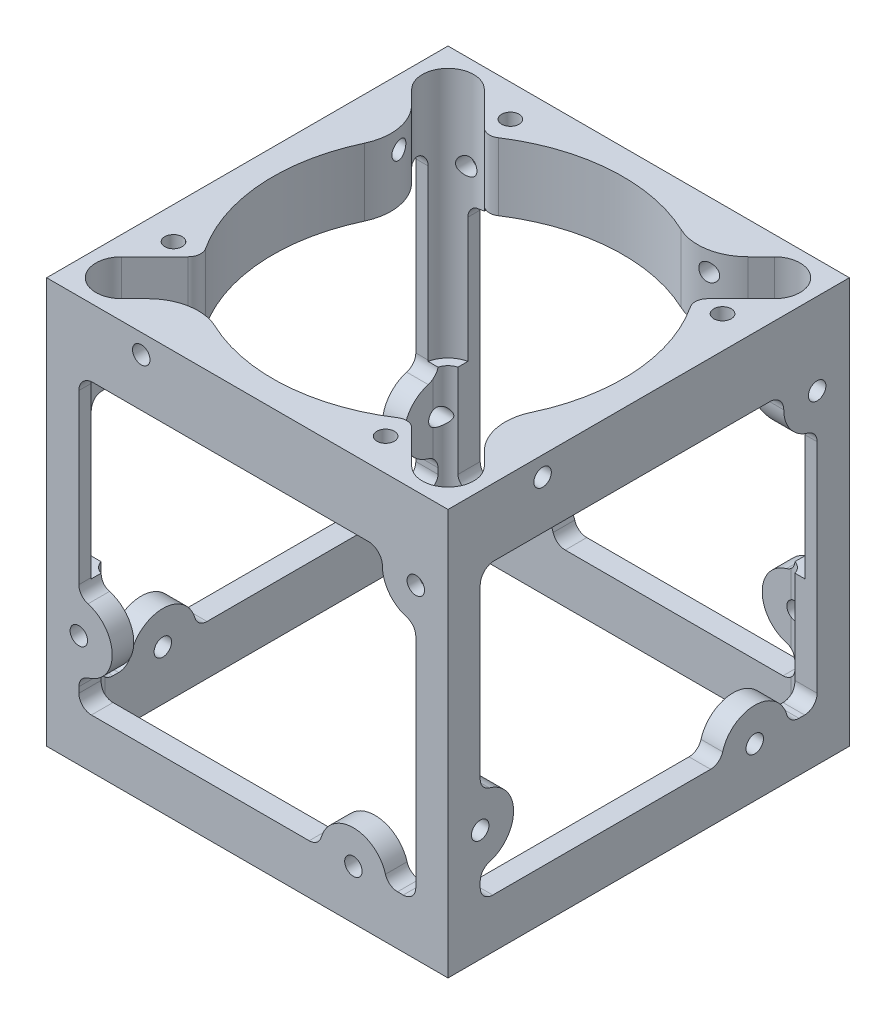
from build123d import *

# Parameters (mm, degrees)
SKETCH1_W           = 50.8
SKETCH1_H           = 50.8
BOSS_EXTRUDE1_DEPTH = 47.5488
CUT_EXTRUDE1_DEPTH  = 33.02
SKETCH4_R           = 1.1049
CUT_EXTRUDE3_DEPTH  = 6.985
SKETCH5_R           = 0.5
SKETCH5_R_2         = 1.1049
CUT_EXTRUDE5_DEPTH  = 6.985
SKETCH6_R           = 0.5
SKETCH6_R_2         = 1.1049
CUT_EXTRUDE6_DEPTH  = 6.985
SKETCH7_R           = 0.5
SKETCH7_R_2         = 1.1049
CUT_EXTRUDE7_DEPTH  = 6.985
CUT_EXTRUDE8_START  = -6.985
SKETCH8_R           = 0.5
SKETCH8_R_2         = 1.1049
CUT_EXTRUDE8_DEPTH  = 6.985
CUT_EXTRUDE9_START  = -6.985
SKETCH9_R           = 0.5
SKETCH9_R_2         = 1.1049
CUT_EXTRUDE9_DEPTH  = 6.985
CUT_EXTRUDE10_DEPTH = 10
CUT_EXTRUDE11_DEPTH = 8.89
CUT_EXTRUDE13_START = -9.99998
CUT_EXTRUDE13_DEPTH = 9.99998
CUT_EXTRUDE14_START = -9.99998
CUT_EXTRUDE14_DEPTH = 9.99998
CUT_EXTRUDE15_DEPTH = 31.75
BOSS_EXTRUDE2_START = 3.81
SKETCH16_W          = 50.8
SKETCH16_H          = 50.8
SKETCH16_R          = 1.1049
BOSS_EXTRUDE2_DEPTH = 3.81


with BuildPart() as part:
    # Sketch1 → Boss-Extrude1 (new body)
    with BuildSketch(Plane(origin=(0, 0, 0), x_dir=(1, 0, 0), z_dir=(0, 1, 0))):
        Rectangle(SKETCH1_W, SKETCH1_H)
    extrude(amount=BOSS_EXTRUDE1_DEPTH)

    # Sketch2 → Cut-Extrude1 (cut)
    with BuildSketch(Plane(origin=(0, 0, 0), x_dir=(-1, 0, 0), z_dir=(0, -1, 0))):
        with BuildLine():
            Line((20.7645, -22.6695), (-20.7645, -22.6695))
            ThreePointArc((-20.7645, -22.6695), (-22.111538418, -22.111538418), (-22.6695, -20.7645))
            Line((-22.6695, -20.7645), (-22.6695, 20.7645))
            ThreePointArc((-22.6695, 20.7645), (-22.111538418, 22.111538418), (-20.7645, 22.6695))
            Line((-20.7645, 22.6695), (20.7645, 22.6695))
            ThreePointArc((20.7645, 22.6695), (22.111538418, 22.111538418), (22.6695, 20.7645))
            Line((22.6695, 20.7645), (22.6695, -20.7645))
            ThreePointArc((22.6695, -20.7645), (22.111538418, -22.111538418), (20.7645, -22.6695))
        make_face()
    extrude(amount=-CUT_EXTRUDE1_DEPTH, mode=Mode.SUBTRACT)

    # Sketch4 → Cut-Extrude3 (cut)
    with BuildSketch(Plane(origin=(0, 0, 0), x_dir=(-1, 0, 0), z_dir=(0, -1, 0))):
        with Locations(Location((-23.495, -23.495, 0), (0, 0, 90))):
            Circle(SKETCH4_R)
        with Locations(Location((23.495, -23.495, 0), (0, 0, 270))):
            Circle(SKETCH4_R)
        with Locations(Location((-23.495, 23.495, 0), (0, 0, 270))):
            Circle(SKETCH4_R)
        with Locations(Location((23.495, 23.495, 0), (0, 0, 90))):
            Circle(SKETCH4_R)
    extrude(amount=-CUT_EXTRUDE3_DEPTH, mode=Mode.SUBTRACT)

    # Sketch5 → Cut-Extrude5 (cut)
    with BuildSketch(Plane(origin=(0, 0, -25.4), x_dir=(-1, 0, 0), z_dir=(0, 0, -1))):
        with Locations((-20.574, 23.7744)):
            Circle(SKETCH5_R)
        with Locations((20.574, 23.7744)):
            Circle(SKETCH5_R)
        with Locations((-21.3233, 10.3505)):
            Circle(SKETCH5_R_2)
        with Locations((-13.4239, 45.0977)):
            Circle(SKETCH5_R_2)
        with Locations((13.4239, 2.4511)):
            Circle(SKETCH5_R_2)
        with Locations(Location((21.3233, 37.1983, 0), (0, 0, 180))):
            Circle(SKETCH5_R_2)
    extrude(amount=-CUT_EXTRUDE5_DEPTH, mode=Mode.SUBTRACT)

    # Sketch6 → Cut-Extrude6 (cut)
    with BuildSketch(Plane.ZY.offset(25.4)):
        with Locations((20.574, 23.7744)):
            Circle(SKETCH6_R)
        with Locations((-20.574, 23.7744)):
            Circle(SKETCH6_R)
        with Locations((-21.3233, 10.3505)):
            Circle(SKETCH6_R_2)
        with Locations((-13.4239, 45.0977)):
            Circle(SKETCH6_R_2)
        with Locations((13.4239, 2.4511)):
            Circle(SKETCH6_R_2)
        with Locations((21.3233, 37.1983)):
            Circle(SKETCH6_R_2)
    extrude(amount=-CUT_EXTRUDE6_DEPTH, mode=Mode.SUBTRACT)

    # Sketch7 → Cut-Extrude7 (cut)
    with BuildSketch(Plane(origin=(0, 47.5488, 0), x_dir=(1, 0, 0), z_dir=(0, 1, 0))):
        with Locations(Location((20.574, 0, 0), (0, 0, 270))):
            Circle(SKETCH7_R)
        with Locations(Location((-20.574, 0, 0), (0, 0, 270))):
            Circle(SKETCH7_R)
        with Locations(Location((-21.3233, -13.4239, 0), (0, 0, 270))):
            Circle(SKETCH7_R_2)
        with Locations(Location((-13.4239, 21.3233, 0), (0, 0, 270))):
            Circle(SKETCH7_R_2)
        with Locations(Location((13.4239, -21.3233, 0), (0, 0, 270))):
            Circle(SKETCH7_R_2)
        with Locations(Location((21.3233, 13.4239, 0), (0, 0, 270))):
            Circle(SKETCH7_R_2)
    extrude(amount=-CUT_EXTRUDE7_DEPTH, mode=Mode.SUBTRACT)

    # Sketch8 → Cut-Extrude8 (cut)
    with BuildSketch(Plane.XY.offset(25.4).offset(CUT_EXTRUDE8_START)):
        with Locations(Location((-20.574, 23.7744, 0), (0, 0, 180))):
            Circle(SKETCH8_R)
        with Locations(Location((20.574, 23.7744, 0), (0, 0, 180))):
            Circle(SKETCH8_R)
        with Locations(Location((-21.3233, 10.3505, 0), (0, 0, 300.380960859))):
            Circle(SKETCH8_R_2)
        with Locations(Location((-13.4239, 45.0977, 0), (0, 0, 180))):
            Circle(SKETCH8_R_2)
        with Locations((13.4239, 2.4511)):
            Circle(SKETCH8_R_2)
        with Locations(Location((21.3233, 37.1983, 0), (0, 0, 180))):
            Circle(SKETCH8_R_2)
    extrude(amount=CUT_EXTRUDE8_DEPTH, mode=Mode.SUBTRACT)

    # Sketch9 → Cut-Extrude9 (cut)
    with BuildSketch(Plane(origin=(25.4, 0, 0), x_dir=(0, 0, -1), z_dir=(1, 0, 0)).offset(CUT_EXTRUDE9_START)):
        with Locations(Location((20.574, 23.7744, 0), (0, 0, 180))):
            Circle(SKETCH9_R)
        with Locations(Location((-20.574, 23.7744, 0), (0, 0, 180))):
            Circle(SKETCH9_R)
        with Locations((-21.3233, 10.3505)):
            Circle(SKETCH9_R_2)
        with Locations((-13.4239, 45.0977)):
            Circle(SKETCH9_R_2)
        with Locations((13.4239, 2.4511)):
            Circle(SKETCH9_R_2)
        with Locations((21.3233, 37.1983)):
            Circle(SKETCH9_R_2)
    extrude(amount=CUT_EXTRUDE9_DEPTH, mode=Mode.SUBTRACT)

    # Sketch10 → Cut-Extrude10 (cut)
    with BuildSketch(Plane.ZY.offset(25.4)):
        with BuildLine():
            Line((15.320052684, 38.998938084), (-19.5453, 38.998938084))
            ThreePointArc((-19.5453, 38.998938084), (-20.802535857, 38.478173941), (-21.3233, 37.220938084))
            Line((-21.3233, 37.220938084), (-21.3233, 15.942312884))
            ThreePointArc((-21.3233, 15.942312884), (-21.002374642, 14.985262768), (-20.169353638, 14.415162763))
            ThreePointArc((-20.169353638, 14.415162763), (-17.09801, 10.3505), (-20.169353638, 6.285837237))
            ThreePointArc((-20.169353638, 6.285837237), (-21.002374642, 5.715737232), (-21.3233, 4.758687116))
            Line((-21.3233, 4.758687116), (-21.3233, 4.0386))
            ThreePointArc((-21.3233, 4.0386), (-20.858332015, 2.916067985), (-19.7358, 2.4511))
            Line((-19.7358, 2.4511), (7.832087116, 2.4511))
            ThreePointArc((7.832087116, 2.4511), (8.789137232, 2.772025358), (9.359237237, 3.605046362))
            ThreePointArc((9.359237237, 3.605046362), (13.4239, 6.67639), (17.488562763, 3.605046362))
            ThreePointArc((17.488562763, 3.605046362), (18.058662768, 2.772025358), (19.015712884, 2.4511))
            Line((19.015712884, 2.4511), (19.7358, 2.4511))
            ThreePointArc((19.7358, 2.4511), (20.858332015, 2.916067985), (21.3233, 4.0386))
            Line((21.3233, 4.0386), (21.3233, 31.606487116))
            ThreePointArc((21.3233, 31.606487116), (21.002374642, 32.563537232), (20.169353638, 33.133637237))
            ThreePointArc((20.169353638, 33.133637237), (17.947388078, 34.657376097), (17.098040042, 37.214233342))
            ThreePointArc((17.098040042, 37.214233342), (16.579656795, 38.475801218), (15.320052684, 38.998938084))
        make_face()
    extrude(amount=-CUT_EXTRUDE10_DEPTH, mode=Mode.SUBTRACT)

    # Sketch11 → Cut-Extrude11 (cut)
    with BuildSketch(Plane.XY.offset(25.4)):
        with BuildLine():
            Line((15.320052684, 38.998938084), (-19.5453, 38.998938084))
            ThreePointArc((-19.5453, 38.998938084), (-20.802535857, 38.478173941), (-21.3233, 37.220938084))
            Line((-21.3233, 37.220938084), (-21.3233, 15.942312884))
            ThreePointArc((-21.3233, 15.942312884), (-21.002374642, 14.985262768), (-20.169353638, 14.415162763))
            ThreePointArc((-20.169353638, 14.415162763), (-17.09801, 10.3505), (-20.169353638, 6.285837237))
            ThreePointArc((-20.169353638, 6.285837237), (-21.002374642, 5.715737232), (-21.3233, 4.758687116))
            Line((-21.3233, 4.758687116), (-21.3233, 4.0386))
            ThreePointArc((-21.3233, 4.0386), (-20.858332015, 2.916067985), (-19.7358, 2.4511))
            Line((-19.7358, 2.4511), (7.832087116, 2.4511))
            ThreePointArc((7.832087116, 2.4511), (8.789137232, 2.772025358), (9.359237237, 3.605046362))
            ThreePointArc((9.359237237, 3.605046362), (13.4239, 6.67639), (17.488562763, 3.605046362))
            ThreePointArc((17.488562763, 3.605046362), (18.058662768, 2.772025358), (19.015712884, 2.4511))
            Line((19.015712884, 2.4511), (19.7358, 2.4511))
            ThreePointArc((19.7358, 2.4511), (20.858332015, 2.916067985), (21.3233, 4.0386))
            Line((21.3233, 4.0386), (21.3233, 31.606487116))
            ThreePointArc((21.3233, 31.606487116), (21.002374642, 32.563537232), (20.169353638, 33.133637237))
            ThreePointArc((20.169353638, 33.133637237), (17.947388078, 34.657376097), (17.098040042, 37.214233342))
            ThreePointArc((17.098040042, 37.214233342), (16.579656795, 38.475801218), (15.320052684, 38.998938084))
        make_face()
    extrude(amount=-CUT_EXTRUDE11_DEPTH, mode=Mode.SUBTRACT)

    # Sketch13 → Cut-Extrude13 (cut)
    with BuildSketch(Plane(origin=(0, 0, -25.4), x_dir=(-1, 0, 0), z_dir=(0, 0, -1)).offset(CUT_EXTRUDE13_START)):
        with BuildLine():
            Line((15.320052684, 38.998938084), (-19.5453, 38.998938084))
            ThreePointArc((-19.5453, 38.998938084), (-20.802535857, 38.478173941), (-21.3233, 37.220938084))
            Line((-21.3233, 37.220938084), (-21.3233, 15.942312884))
            ThreePointArc((-21.3233, 15.942312884), (-21.002374642, 14.985262768), (-20.169353638, 14.415162763))
            ThreePointArc((-20.169353638, 14.415162763), (-17.09801, 10.3505), (-20.169353638, 6.285837237))
            ThreePointArc((-20.169353638, 6.285837237), (-21.002374642, 5.715737232), (-21.3233, 4.758687116))
            Line((-21.3233, 4.758687116), (-21.3233, 4.0386))
            ThreePointArc((-21.3233, 4.0386), (-20.858332015, 2.916067985), (-19.7358, 2.4511))
            Line((-19.7358, 2.4511), (7.832087116, 2.4511))
            ThreePointArc((7.832087116, 2.4511), (8.789137232, 2.772025358), (9.359237237, 3.605046362))
            ThreePointArc((9.359237237, 3.605046362), (13.4239, 6.67639), (17.488562763, 3.605046362))
            ThreePointArc((17.488562763, 3.605046362), (18.058662768, 2.772025358), (19.015712884, 2.4511))
            Line((19.015712884, 2.4511), (19.7358, 2.4511))
            ThreePointArc((19.7358, 2.4511), (20.858332015, 2.916067985), (21.3233, 4.0386))
            Line((21.3233, 4.0386), (21.3233, 31.606487116))
            ThreePointArc((21.3233, 31.606487116), (21.002374642, 32.563537232), (20.169353638, 33.133637237))
            ThreePointArc((20.169353638, 33.133637237), (17.947388078, 34.657376097), (17.098040042, 37.214233342))
            ThreePointArc((17.098040042, 37.214233342), (16.579656795, 38.475801218), (15.320052684, 38.998938084))
        make_face()
    extrude(amount=CUT_EXTRUDE13_DEPTH, mode=Mode.SUBTRACT)

    # Sketch14 → Cut-Extrude14 (cut)
    with BuildSketch(Plane(origin=(25.4, 0, 0), x_dir=(0, 0, -1), z_dir=(1, 0, 0)).offset(CUT_EXTRUDE14_START)):
        with BuildLine():
            Line((15.320052684, 38.998938084), (-19.5453, 38.998938084))
            ThreePointArc((-19.5453, 38.998938084), (-20.802535857, 38.478173941), (-21.3233, 37.220938084))
            Line((-21.3233, 37.220938084), (-21.3233, 15.942312884))
            ThreePointArc((-21.3233, 15.942312884), (-21.002374642, 14.985262768), (-20.169353638, 14.415162763))
            ThreePointArc((-20.169353638, 14.415162763), (-17.09801, 10.3505), (-20.169353638, 6.285837237))
            ThreePointArc((-20.169353638, 6.285837237), (-21.002374642, 5.715737232), (-21.3233, 4.758687116))
            Line((-21.3233, 4.758687116), (-21.3233, 4.0386))
            ThreePointArc((-21.3233, 4.0386), (-20.858332015, 2.916067985), (-19.7358, 2.4511))
            Line((-19.7358, 2.4511), (7.832087116, 2.4511))
            ThreePointArc((7.832087116, 2.4511), (8.789137232, 2.772025358), (9.359237237, 3.605046362))
            ThreePointArc((9.359237237, 3.605046362), (13.4239, 6.67639), (17.488562763, 3.605046362))
            ThreePointArc((17.488562763, 3.605046362), (18.058662768, 2.772025358), (19.015712884, 2.4511))
            Line((19.015712884, 2.4511), (19.7358, 2.4511))
            ThreePointArc((19.7358, 2.4511), (20.858332015, 2.916067985), (21.3233, 4.0386))
            Line((21.3233, 4.0386), (21.3233, 31.606487116))
            ThreePointArc((21.3233, 31.606487116), (21.002374642, 32.563537232), (20.169353638, 33.133637237))
            ThreePointArc((20.169353638, 33.133637237), (17.947388078, 34.657376097), (17.098040042, 37.214233342))
            ThreePointArc((17.098040042, 37.214233342), (16.579656795, 38.475801218), (15.320052684, 38.998938084))
        make_face()
    extrude(amount=CUT_EXTRUDE14_DEPTH, mode=Mode.SUBTRACT)

    # Sketch15 → Cut-Extrude15 (cut)
    with BuildSketch(Plane(origin=(0, 47.5488, 0), x_dir=(1, 0, 0), z_dir=(0, 1, 0))):
        with BuildLine():
            Line((-18.355643511, 22.953534645), (-14.141887491, 18.739778625))
            ThreePointArc((-14.141887491, 18.739778625), (-13.181931515, 18.283157297), (-12.149077704, 18.534616079))
            ThreePointArc((-12.149077704, 18.534616079), (-1.531041807, 22.108550229), (9.478273295, 20.032334302))
            ThreePointArc((9.478273295, 20.032334302), (13.27924871, 19.515663572), (16.684238976, 21.28213011))
            Line((16.684238976, 21.28213011), (18.355643511, 22.953534645))
            ThreePointArc((18.355643511, 22.953534645), (22.953534645, 22.953534645), (22.953534645, 18.355643511))
            Line((22.953534645, 18.355643511), (18.739778625, 14.141887491))
            ThreePointArc((18.739778625, 14.141887491), (18.283157297, 13.181931515), (18.534616079, 12.149077704))
            ThreePointArc((18.534616079, 12.149077704), (22.108550229, 1.531041807), (20.032334302, -9.478273295))
            ThreePointArc((20.032334302, -9.478273295), (19.515663572, -13.27924871), (21.28213011, -16.684238976))
            Line((21.28213011, -16.684238976), (22.953534645, -18.355643511))
            ThreePointArc((22.953534645, -18.355643511), (22.953534645, -22.953534645), (18.355643511, -22.953534645))
            Line((18.355643511, -22.953534645), (14.141887491, -18.739778625))
            ThreePointArc((14.141887491, -18.739778625), (13.181931515, -18.283157297), (12.149077704, -18.534616079))
            ThreePointArc((12.149077704, -18.534616079), (1.531041807, -22.108550229), (-9.478273295, -20.032334302))
            ThreePointArc((-9.478273295, -20.032334302), (-13.27924871, -19.515663572), (-16.684238976, -21.28213011))
            Line((-16.684238976, -21.28213011), (-18.355643511, -22.953534645))
            ThreePointArc((-18.355643511, -22.953534645), (-22.953534645, -22.953534645), (-22.953534645, -18.355643511))
            Line((-22.953534645, -18.355643511), (-18.739778625, -14.141887491))
            ThreePointArc((-18.739778625, -14.141887491), (-18.283157297, -13.181931515), (-18.534616079, -12.149077704))
            ThreePointArc((-18.534616079, -12.149077704), (-22.108550229, -1.531041807), (-20.032334302, 9.478273295))
            ThreePointArc((-20.032334302, 9.478273295), (-19.515663572, 13.27924871), (-21.28213011, 16.684238976))
            Line((-21.28213011, 16.684238976), (-22.953534645, 18.355643511))
            ThreePointArc((-22.953534645, 18.355643511), (-22.953534645, 22.953534645), (-18.355643511, 22.953534645))
        make_face()
    extrude(amount=-CUT_EXTRUDE15_DEPTH, mode=Mode.SUBTRACT)

    # Sketch16 → Boss-Extrude2 (add)
    with BuildSketch(Plane(origin=(0, 0, 0), x_dir=(-1, 0, 0), z_dir=(0, -1, 0)).offset(BOSS_EXTRUDE2_START)):
        Rectangle(SKETCH16_W, SKETCH16_H)
        with Locations(Location((-23.495, 23.495, 0), (0, 0, 90))):
            Circle(SKETCH16_R, mode=Mode.SUBTRACT)
        with Locations(Location((23.495, 23.495, 0), (0, 0, 90))):
            Circle(SKETCH16_R, mode=Mode.SUBTRACT)
        with Locations(Location((-23.495, -23.495, 0), (0, 0, 90))):
            Circle(SKETCH16_R, mode=Mode.SUBTRACT)
        with Locations(Location((23.495, -23.495, 0), (0, 0, 90))):
            Circle(SKETCH16_R, mode=Mode.SUBTRACT)
        with BuildLine():
            Line((-20.7645, -22.6695), (20.7645, -22.6695))
            ThreePointArc((20.7645, -22.6695), (22.111538418, -22.111538418), (22.6695, -20.7645))
            Line((22.6695, -20.7645), (22.6695, 20.7645))
            ThreePointArc((22.6695, 20.7645), (22.111538418, 22.111538418), (20.7645, 22.6695))
            Line((20.7645, 22.6695), (-20.7645, 22.6695))
            ThreePointArc((-20.7645, 22.6695), (-22.111538418, 22.111538418), (-22.6695, 20.7645))
            Line((-22.6695, 20.7645), (-22.6695, -20.7645))
            ThreePointArc((-22.6695, -20.7645), (-22.111538418, -22.111538418), (-20.7645, -22.6695))
        make_face(mode=Mode.SUBTRACT)
    extrude(amount=-BOSS_EXTRUDE2_DEPTH)


solid = part.part
